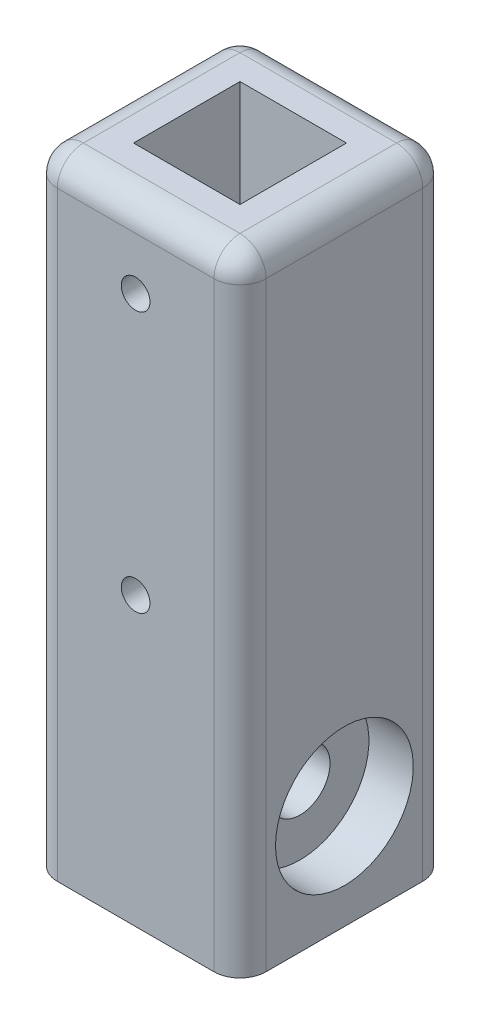
from build123d import *

# Parameters (mm, degrees)
SKETCH1_W               = 40
SKETCH1_H               = 40
SKETCH1_W_2             = 20.4
SKETCH1_H_2             = 20.4
BOSS_EXTRUDE1_DEPTH     = 80
SKETCH1_2_W             = 40
SKETCH1_2_H             = 40
SKETCH1_2_W_2           = 20.4
SKETCH1_2_H_2           = 20.4
BOSS_EXTRUDE2_DEPTH     = 40
CUT_EXTRUDE1_DEPTH      = 91.68671347
CUT_EXTRUDE1_DEPTH_BACK = 91.68671347
SKETCH2_R               = 2.75
SKETCH3_R               = 13.2
SKETCH3_R_2             = 5.75
CUT_EXTRUDE2_DEPTH      = 8.5
CUT_EXTRUDE3_START      = -31.5
SKETCH3_3_R             = 13.2
SKETCH3_3_R_2           = 5.75
CUT_EXTRUDE3_DEPTH      = 8.5
SKETCH3_4_R             = 5.75
CUT_EXTRUDE4_DEPTH      = 95.403601626
FILLET1_R               = 5
FILLET2_R               = 5


with BuildPart() as part:
    # Sketch1 → Boss-Extrude1 (new body)
    with BuildSketch(Plane(origin=(0, 0, 0), x_dir=(1, 0, 0), z_dir=(0, 1, 0))):
        with Locations((10.2, 10.2)):
            Rectangle(SKETCH1_W, SKETCH1_H)
        with Locations((10.2, 10.2)):
            Rectangle(SKETCH1_W_2, SKETCH1_H_2, mode=Mode.SUBTRACT)
    extrude(amount=BOSS_EXTRUDE1_DEPTH)

    # Sketch1<2> → Boss-Extrude2 (add)
    # profile 1 of 2: a face of its own
    with BuildSketch(Plane(origin=(0, 0, 0), x_dir=(1, 0, 0), z_dir=(0, 1, 0))):
        with Locations((10.2, 10.2)):
            Rectangle(SKETCH1_2_W, SKETCH1_2_H)
        with Locations((10.2, 10.2)):
            Rectangle(SKETCH1_2_W_2, SKETCH1_2_H_2, mode=Mode.SUBTRACT)
    # profile 2 of 2: a face of its own
    with BuildSketch(Plane(origin=(0, 0, 0), x_dir=(1, 0, 0), z_dir=(0, 1, 0))):
        with Locations((10.2, 10.2)):
            Rectangle(SKETCH1_2_W_2, SKETCH1_2_H_2)
    extrude(amount=-BOSS_EXTRUDE2_DEPTH)

    # Sketch2 → Cut-Extrude1 (cut, two sides: drawn at the far end of the back side and taken through both)
    with BuildSketch(Plane(origin=(0, 0, 0), x_dir=(-1, 0, 0), z_dir=(0, 0, -1)).offset(-CUT_EXTRUDE1_DEPTH_BACK)):
        with Locations((-10.2, 15)):
            Circle(SKETCH2_R)
        with Locations((-10.2, 65)):
            Circle(SKETCH2_R)
    extrude(amount=CUT_EXTRUDE1_DEPTH + CUT_EXTRUDE1_DEPTH_BACK, mode=Mode.SUBTRACT)

    # Sketch3 → Cut-Extrude2 (cut)
    with BuildSketch(Plane.ZY.offset(9.8)):
        with Locations((-10.2, -20)):
            Circle(SKETCH3_R)
        with Locations((-10.2, -20)):
            Circle(SKETCH3_R_2, mode=Mode.SUBTRACT)
    extrude(amount=-CUT_EXTRUDE2_DEPTH, mode=Mode.SUBTRACT)

    # Sketch3<3> → Cut-Extrude3 (cut)
    with BuildSketch(Plane.ZY.offset(9.8).offset(CUT_EXTRUDE3_START)):
        with Locations((-10.2, -20)):
            Circle(SKETCH3_3_R)
        with Locations((-10.2, -20)):
            Circle(SKETCH3_3_R_2, mode=Mode.SUBTRACT)
    extrude(amount=-CUT_EXTRUDE3_DEPTH, mode=Mode.SUBTRACT)

    # Sketch3<4> → Cut-Extrude4 (cut, through all)
    with BuildSketch(Plane.ZY.offset(9.8)):
        with Locations((-10.2, -20)):
            Circle(SKETCH3_4_R)
    extrude(amount=-CUT_EXTRUDE4_DEPTH, mode=Mode.SUBTRACT)

    # Fillet1
    fillet1_edges = [part.edges().sort_by_distance(p)[0] for p in [
        (-9.8, 20, -30.2),
        (30.2, 20, -30.2),
        (30.2, 20, 9.8),
        (-9.8, 20, 9.8),
    ]]
    fillet(fillet1_edges, radius=FILLET1_R)

    # Fillet2
    fillet2_edges = [part.edges().sort_by_distance(p)[0] for p in [
        (-9.8, 80, -10.2),
        (10.2, 80, -30.2),
        (10.2, 80, 9.8),
        (30.2, 80, -10.2),
        (28.735533906, 80, -28.735533906),
        (28.735533906, 80, 8.335533906),
        (-8.335533906, 80, 8.335533906),
        (-8.335533906, 80, -28.735533906),
    ]]
    fillet(fillet2_edges, radius=FILLET2_R)


solid = part.part
